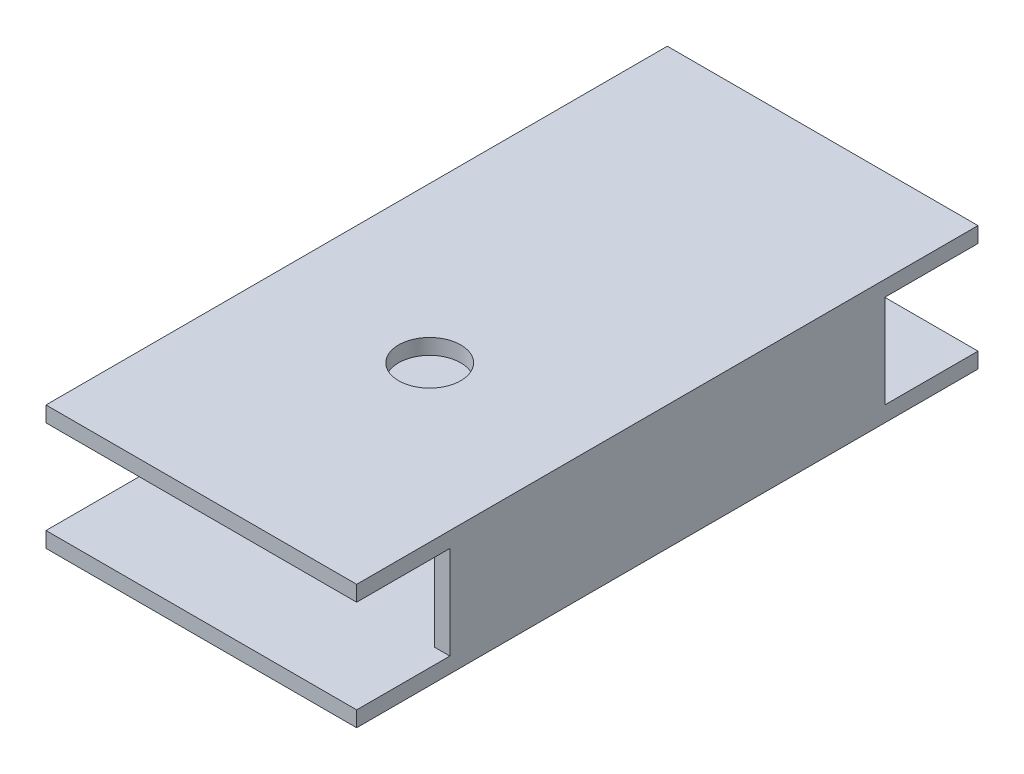
from build123d import *

# Parameters (mm, degrees)
SKETCH1_W           = 63.5
SKETCH1_H           = 25.4
SKETCH1_W_2         = 57.15
SKETCH1_H_2         = 19.05
EXTRUDE_THIN1_DEPTH = 127
SKETCH2_W           = 19.05
SKETCH2_H           = 19.05
CUT_EXTRUDE1_DEPTH  = 145.244271983
SKETCH3_W           = 19.05
SKETCH3_H           = 19.05
CUT_EXTRUDE2_DEPTH  = 145.244271983
SKETCH4_R           = 6.35
CUT_EXTRUDE3_DEPTH  = 145.244271983


with BuildPart() as part:
    # Sketch1 → Extrude-Thin1 (new body)
    with BuildSketch(Plane.XY):
        with Locations((31.75, 12.7)):
            Rectangle(SKETCH1_W, SKETCH1_H)
        with Locations((31.75, 12.7)):
            Rectangle(SKETCH1_W_2, SKETCH1_H_2, mode=Mode.SUBTRACT)
    extrude(amount=EXTRUDE_THIN1_DEPTH)

    # Sketch2 → Cut-Extrude1 (cut, through all)
    with BuildSketch(Plane(origin=(63.5, 0, 0), x_dir=(0, 0, -1), z_dir=(1, 0, 0))):
        with Locations((-9.525, 12.7)):
            Rectangle(SKETCH2_W, SKETCH2_H)
    extrude(amount=-CUT_EXTRUDE1_DEPTH, mode=Mode.SUBTRACT)

    # Sketch3 → Cut-Extrude2 (cut, through all)
    with BuildSketch(Plane(origin=(63.5, 0, 0), x_dir=(0, 0, -1), z_dir=(1, 0, 0))):
        with Locations((-117.475, 12.7)):
            Rectangle(SKETCH3_W, SKETCH3_H)
    extrude(amount=-CUT_EXTRUDE2_DEPTH, mode=Mode.SUBTRACT)

    # Sketch4 → Cut-Extrude3 (cut, through all)
    with BuildSketch(Plane(origin=(0, 25.4, 0), x_dir=(1, 0, 0), z_dir=(0, 1, 0))):
        with Locations(Location((31.75, -80.3275, 0), (0, 0, 270))):
            Circle(SKETCH4_R)
    extrude(amount=-CUT_EXTRUDE3_DEPTH, mode=Mode.SUBTRACT)


solid = part.part
